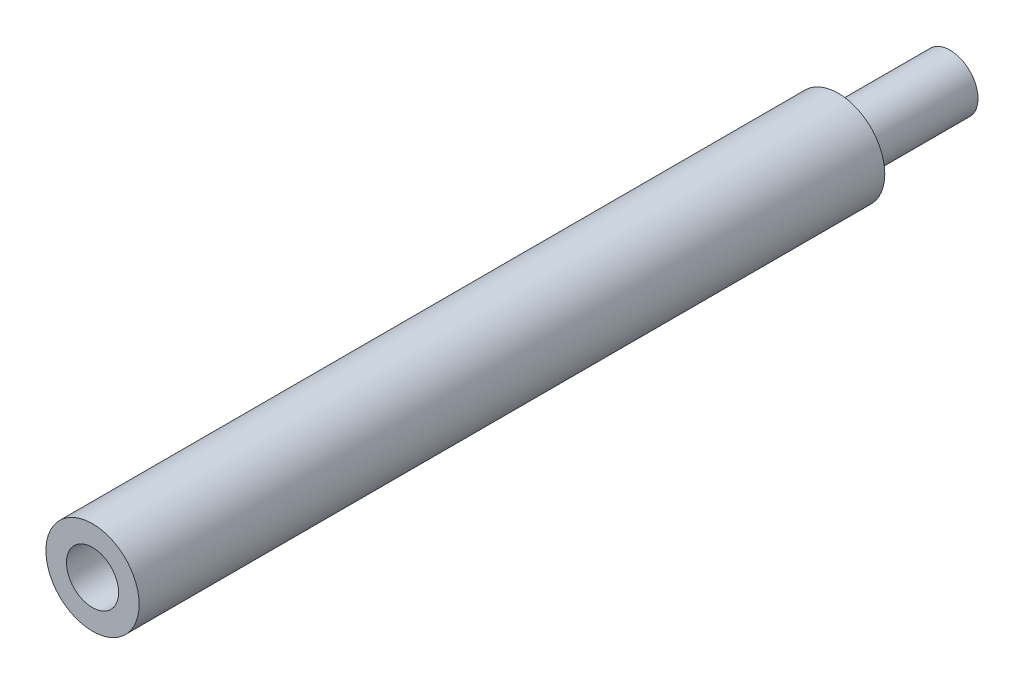
from build123d import *

# Parameters (mm, degrees)
SKETCH_1_R      = 2.5
SKETCH_1_R_2    = 1.4
EXTRUDE_1_DEPTH = 40
SKETCH_2_R      = 1.5
EXTRUDE_2_DEPTH = 6


with BuildPart() as part:
    # 草图1 → 凸台-拉伸1 (new body)
    with BuildSketch(Plane.XY):
        Circle(SKETCH_1_R)
        Circle(SKETCH_1_R_2, mode=Mode.SUBTRACT)
    extrude(amount=EXTRUDE_1_DEPTH)

    # 草图2 → 凸台-拉伸2 (add)
    with BuildSketch(Plane(origin=(0, 0, 0), x_dir=(-1, 0, 0), z_dir=(0, 0, -1))):
        with Locations(Location((0, 0, 0), (0, 0, 180))):
            Circle(SKETCH_2_R)
    extrude(amount=EXTRUDE_2_DEPTH)


solid = part.part
